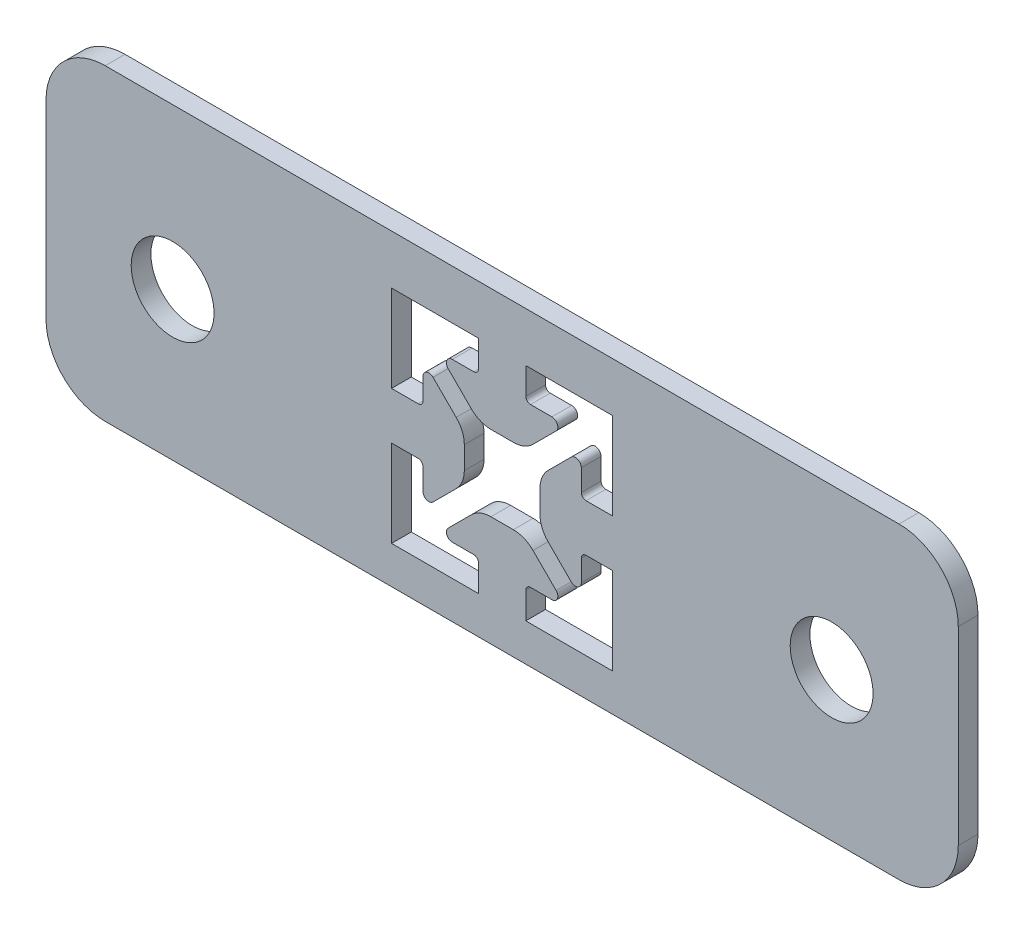
from build123d import *

# Parameters (mm, degrees)
SKETCH1_R           = 4.198469776
BOSS_EXTRUDE1_DEPTH = 2


with BuildPart() as part:
    # Sketch1 → Boss-Extrude1 (new body)
    with BuildSketch(Plane(origin=(0, 0, 1287.795194646), x_dir=(-1, 0, 0), z_dir=(0, 0, -1))):
        with BuildLine():
            Line((-628.291713491, 871.098927157), (-628.291713491, 890.298927157))
            ThreePointArc((-628.291713491, 890.298927157), (-630.049072803, 894.541567844), (-634.291713491, 896.298927157))
            Line((-634.291713491, 896.298927157), (-714.691713491, 896.298927157))
            ThreePointArc((-714.691713491, 896.298927157), (-718.934354178, 894.541567844), (-720.691713491, 890.298927157))
            Line((-720.691713491, 890.298927157), (-720.691713491, 871.098927157))
            ThreePointArc((-720.691713491, 871.098927157), (-718.934354178, 866.85628647), (-714.691713491, 865.098927157))
            Line((-714.691713491, 865.098927157), (-634.291713491, 865.098927157))
            ThreePointArc((-634.291713491, 865.098927157), (-630.049072803, 866.85628647), (-628.291713491, 871.098927157))
        make_face()
        with Locations((-707.866713491, 880.098927157)):
            Circle(SKETCH1_R, mode=Mode.SUBTRACT)
        with Locations((-641.116713491, 880.098927157)):
            Circle(SKETCH1_R, mode=Mode.SUBTRACT)
        with BuildLine():
            Line((-682.991714253, 882.493927157), (-685.691713491, 882.493927157))
            Line((-685.691713491, 882.493927157), (-685.691713491, 891.298927157))
            Line((-685.691713491, 891.298927157), (-676.886713491, 891.298927157))
            Line((-676.886713491, 891.298927157), (-676.886713491, 888.59892792))
            ThreePointArc((-676.886713491, 888.59892792), (-677.027302174, 888.259516726), (-677.366713318, 888.11892792))
            Line((-677.366713318, 888.11892792), (-679.535834903, 888.118927139))
            ThreePointArc((-679.535834903, 888.118927139), (-680.090162448, 887.748537098), (-679.960098756, 887.09466307))
            Line((-679.960098756, 887.09466307), (-677.620321725, 884.754886039))
            ThreePointArc((-677.620321725, 884.754886039), (-676.705447884, 884.143586882), (-675.626280608, 883.928927162))
            Line((-675.626280608, 883.928927162), (-673.357146389, 883.928927157))
            ThreePointArc((-673.357146389, 883.928927157), (-672.277979107, 884.143586875), (-671.363105261, 884.754886034))
            Line((-671.363105261, 884.754886034), (-669.023328231, 887.094663064))
            ThreePointArc((-669.023328231, 887.094663064), (-668.893264539, 887.748537091), (-669.447592082, 888.118927133))
            Line((-669.447592082, 888.118927133), (-671.616713665, 888.11892792))
            ThreePointArc((-671.616713665, 888.11892792), (-671.956124807, 888.259516727), (-672.096713491, 888.59892792))
            Line((-672.096713491, 888.59892792), (-672.096713491, 891.298927157))
            Line((-672.096713491, 891.298927157), (-663.291713491, 891.298927157))
            Line((-663.291713491, 891.298927157), (-663.291713491, 882.493927157))
            Line((-663.291713491, 882.493927157), (-665.991712728, 882.493927157))
            ThreePointArc((-665.991712728, 882.493927157), (-666.331123921, 882.634515841), (-666.471712728, 882.973926984))
            Line((-666.471712728, 882.973926984), (-666.471713509, 885.14304857))
            ThreePointArc((-666.471713509, 885.14304857), (-666.84210355, 885.697376115), (-667.495977578, 885.567312423))
            Line((-667.495977578, 885.567312423), (-669.835754609, 883.227535392))
            ThreePointArc((-669.835754609, 883.227535392), (-670.447053766, 882.312661551), (-670.661713486, 881.233494275))
            Line((-670.661713486, 881.233494275), (-670.66171349, 878.964360056))
            ThreePointArc((-670.66171349, 878.964360056), (-670.447053773, 877.885192774), (-669.835754613, 876.970318927))
            Line((-669.835754613, 876.970318927), (-667.495977584, 874.630541898))
            ThreePointArc((-667.495977584, 874.630541898), (-666.842103556, 874.500478205), (-666.471713515, 875.054805749))
            Line((-666.471713515, 875.054805749), (-666.471712728, 877.223927331))
            ThreePointArc((-666.471712728, 877.223927331), (-666.331123921, 877.563338474), (-665.991712728, 877.703927157))
            Line((-665.991712728, 877.703927157), (-663.291713491, 877.703927157))
            Line((-663.291713491, 877.703927157), (-663.291713491, 868.898927157))
            Line((-663.291713491, 868.898927157), (-672.096713491, 868.898927157))
            Line((-672.096713491, 868.898927157), (-672.096713491, 871.598926394))
            ThreePointArc((-672.096713491, 871.598926394), (-671.956124807, 871.938337588), (-671.616713663, 872.078926394))
            Line((-671.616713663, 872.078926394), (-669.447592078, 872.078927176))
            ThreePointArc((-669.447592078, 872.078927176), (-668.893264533, 872.449317216), (-669.023328225, 873.103191245))
            Line((-669.023328225, 873.103191245), (-671.363105256, 875.442968275))
            ThreePointArc((-671.363105256, 875.442968275), (-672.277979097, 876.054267433), (-673.357146373, 876.268927152))
            Line((-673.357146373, 876.268927152), (-675.626280592, 876.268927157))
            ThreePointArc((-675.626280592, 876.268927157), (-676.705447874, 876.05426744), (-677.62032172, 875.44296828))
            Line((-677.62032172, 875.44296828), (-679.96009875, 873.103191251))
            ThreePointArc((-679.96009875, 873.103191251), (-680.090162442, 872.449317223), (-679.535834899, 872.078927182))
            Line((-679.535834899, 872.078927182), (-677.366713316, 872.078926394))
            ThreePointArc((-677.366713316, 872.078926394), (-677.027302174, 871.938337588), (-676.886713491, 871.598926394))
            Line((-676.886713491, 871.598926394), (-676.886713491, 868.898927157))
            Line((-676.886713491, 868.898927157), (-685.691713491, 868.898927157))
            Line((-685.691713491, 868.898927157), (-685.691713491, 877.703927157))
            Line((-685.691713491, 877.703927157), (-682.991714253, 877.703927157))
            ThreePointArc((-682.991714253, 877.703927157), (-682.65230306, 877.563338473), (-682.511714253, 877.22392733))
            Line((-682.511714253, 877.22392733), (-682.511713472, 875.054805744))
            ThreePointArc((-682.511713472, 875.054805744), (-682.141323432, 874.5004782), (-681.487449403, 874.630541892))
            Line((-681.487449403, 874.630541892), (-679.147672372, 876.970318923))
            ThreePointArc((-679.147672372, 876.970318923), (-678.536373215, 877.885192764), (-678.321713495, 878.96436004))
            Line((-678.321713495, 878.96436004), (-678.321713491, 881.233494258))
            ThreePointArc((-678.321713491, 881.233494258), (-678.536373208, 882.312661541), (-679.147672368, 883.227535387))
            Line((-679.147672368, 883.227535387), (-681.487449397, 885.567312417))
            ThreePointArc((-681.487449397, 885.567312417), (-682.141323425, 885.697376109), (-682.511713466, 885.143048566))
            Line((-682.511713466, 885.143048566), (-682.511714253, 882.973926983))
            ThreePointArc((-682.511714253, 882.973926983), (-682.65230306, 882.634515841), (-682.991714253, 882.493927157))
        make_face(mode=Mode.SUBTRACT)
    extrude(amount=BOSS_EXTRUDE1_DEPTH)


solid = part.part
